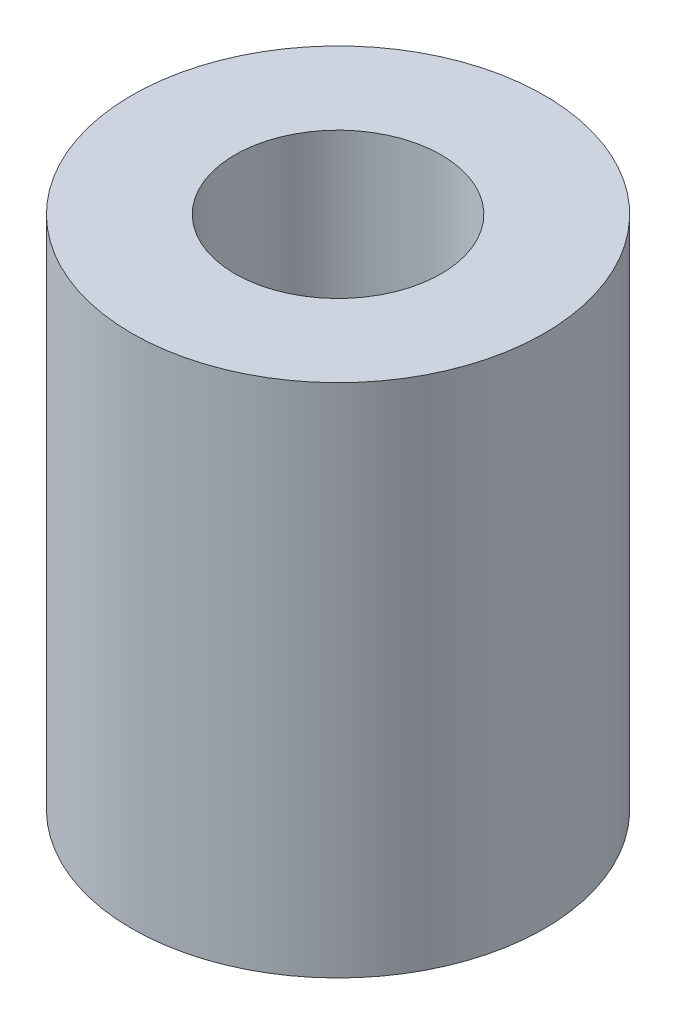
from build123d import *

# Parameters (mm, degrees)
SKETCH1_R           = 6.35
BOSS_EXTRUDE1_DEPTH = 15.875
SKETCH2_R           = 3.175
CUT_EXTRUDE1_DEPTH  = 19.238986403


with BuildPart() as part:
    # Sketch1 → Boss-Extrude1 (new body)
    with BuildSketch(Plane(origin=(0, 0, 0), x_dir=(1, 0, 0), z_dir=(0, 1, 0))):
        with Locations(Location((0, 0, 0), (0, 0, 270))):
            Circle(SKETCH1_R)
    extrude(amount=BOSS_EXTRUDE1_DEPTH)

    # Sketch2 → Cut-Extrude1 (cut, through all)
    with BuildSketch(Plane(origin=(0, 15.875, 0), x_dir=(1, 0, 0), z_dir=(0, 1, 0))):
        with Locations(Location((0, 0, 0), (0, 0, 270))):
            Circle(SKETCH2_R)
    extrude(amount=-CUT_EXTRUDE1_DEPTH, mode=Mode.SUBTRACT)


solid = part.part
